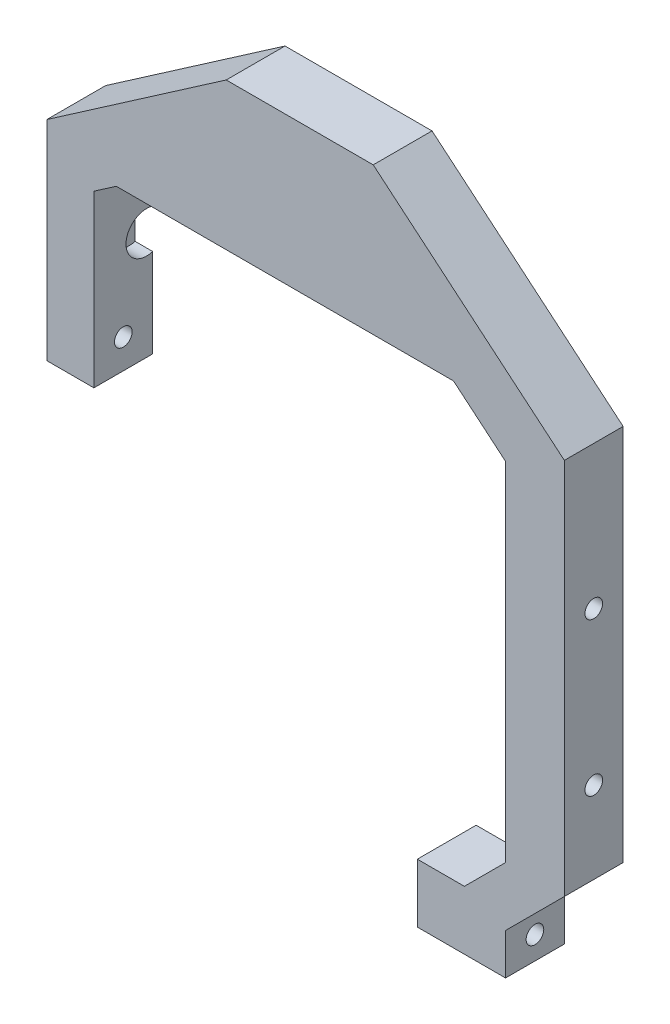
from build123d import *

# Parameters (mm, degrees)
BOSS_EXTRUDE1_DEPTH = 10
SKETCH2_R           = 1.5
CUT_EXTRUDE1_DEPTH  = 141.05802369
CUT_EXTRUDE2_REACH  = 142.058
SKETCH3_R           = 1.5
CHAMFER2_SIZE       = 7
CUT_EXTRUDE3_REACH  = 124.28
CUT_EXTRUDE4_REACH  = 136.001
SKETCH5_R           = 1.5
SKETCH9_R           = 3.5
CUT_EXTRUDE7_DEPTH  = 3
CUT_EXTRUDE8_START  = -3
SKETCH10_R          = 3.5
CUT_EXTRUDE8_DEPTH  = 3


with BuildPart() as part:
    # Sketch1 → Boss-Extrude1 (new body)
    with BuildSketch(Plane(origin=(0, 0, 0), x_dir=(-1, 0, 0), z_dir=(0, 0, 1))):
        Polygon((47.5, 36.642135619), (47.5, 56.593701556), (55.5, 56.593701556), (55.5, 30.499999996), (55.5, 21.076918494), (25, 0), (0, 0), (-32.5, 27.270738013), (-32.5, 40.5), (-32.5, 108.5), (-7.5, 108.5), (-7.5, 98.5), (-22.5, 98.5), (-22.5, 32.416456895), (-13.661410851, 25), (35.857864376, 25), (43.690340999, 25), (47.5, 27.632651549), align=None)
    extrude(amount=BOSS_EXTRUDE1_DEPTH)

    # Sketch2 → Cut-Extrude1 (cut, through all)
    with BuildSketch(Plane.ZY.offset(55.5)):
        with Locations(Location((5, -51.593701556, 0), (0, 0, 270))):
            Circle(SKETCH2_R)
    extrude(amount=-CUT_EXTRUDE1_DEPTH, mode=Mode.SUBTRACT)

    # Sketch3 → Cut-Extrude2 (cut, up to next)
    with BuildSketch(Plane(origin=(32.5, 0, 0), x_dir=(0, 0, -1), z_dir=(1, 0, 0)), mode=Mode.PRIVATE) as cut_extrude2_sk1:
        with Locations(Location((-5, -77.593701556, 0), (0, 0, 90))):
            Circle(SKETCH3_R)
    cut_extrude2_tool1 = extrude(cut_extrude2_sk1.sketch, amount=-CUT_EXTRUDE2_REACH, mode=Mode.PRIVATE) & part.part
    add(cut_extrude2_tool1.solids().sort_by_distance((32.5, -77.593702, 5))[0], mode=Mode.SUBTRACT)

    # Chamfer2
    chamfer2_edges = [part.edges().sort_by_distance(p)[0] for p in [
        (22.5, -98.5, 5),
    ]]
    chamfer(chamfer2_edges, length=CHAMFER2_SIZE)

    # Sketch4 → Cut-Extrude3 (cut, up to next)
    with BuildSketch(Plane.XY.offset(10), mode=Mode.PRIVATE) as cut_extrude3_sk1:
        Polygon((22.5, -108.5), (22.5, -101.5), (32.5, -91.5), (32.5, -108.5), align=None)
    cut_extrude3_tool1 = extrude(cut_extrude3_sk1.sketch, amount=-CUT_EXTRUDE3_REACH, mode=Mode.PRIVATE) & part.part
    add(cut_extrude3_tool1.solids().sort_by_distance((28.194444, -102.152778, 10))[0], mode=Mode.SUBTRACT)

    # Sketch5 → Cut-Extrude4 (cut, up to next)
    with BuildSketch(Plane(origin=(22.5, 0, 0), x_dir=(0, 0, -1), z_dir=(1, 0, 0)), mode=Mode.PRIVATE) as cut_extrude4_sk1:
        with Locations((-5, -104.593701556)):
            Circle(SKETCH5_R)
    cut_extrude4_tool1 = extrude(cut_extrude4_sk1.sketch, amount=-CUT_EXTRUDE4_REACH, mode=Mode.PRIVATE) & part.part
    add(cut_extrude4_tool1.solids().sort_by_distance((22.5, -104.593702, 5))[0], mode=Mode.SUBTRACT)

    # Sketch9 → Cut-Extrude7 (cut)
    with BuildSketch(Plane(origin=(-47.5, 0, 0), x_dir=(0, 0, -1), z_dir=(1, 0, 0))):
        with Locations((-1.036207833, -38.166551759)):
            Circle(SKETCH9_R)
    extrude(amount=-CUT_EXTRUDE7_DEPTH, mode=Mode.SUBTRACT)

    # Sketch10 → Cut-Extrude8 (cut)
    with BuildSketch(Plane.ZY.offset(-22.5).offset(CUT_EXTRUDE8_START)):
        with Locations((1.036207833, -38.166551759)):
            Circle(SKETCH10_R)
        with Locations((1.036207833, -64.166551759)):
            Circle(SKETCH10_R)
    extrude(amount=CUT_EXTRUDE8_DEPTH, mode=Mode.SUBTRACT)


solid = part.part
